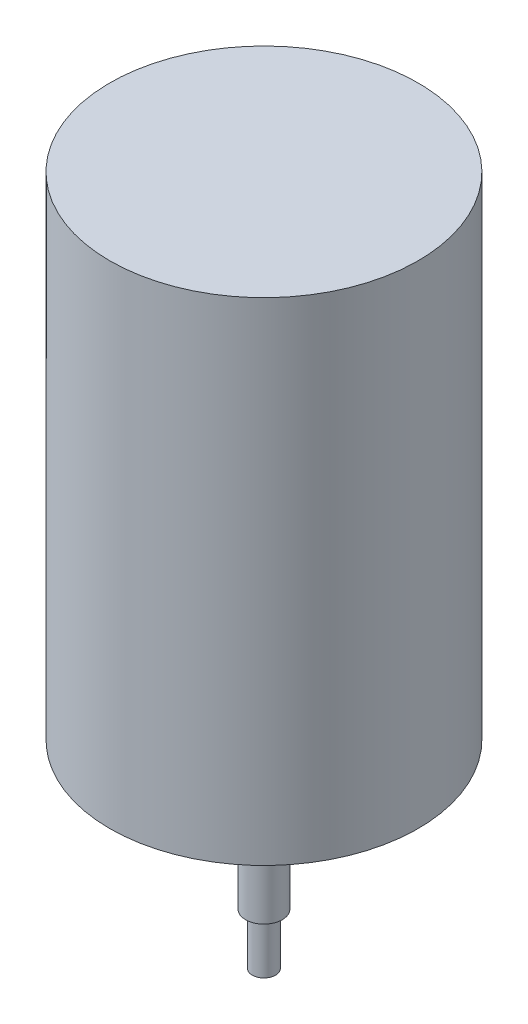
from build123d import *

# Parameters (mm, degrees)
SKETCH_1_R      = 21
EXTRUDE_1_DEPTH = 67
SKETCH_2_R      = 2.5
EXTRUDE_2_DEPTH = 20
SKETCH_3_R      = 1.5875
EXTRUDE_3_DEPTH = 7


with BuildPart() as part:
    # 草图1 → 凸台-拉伸1 (new body)
    with BuildSketch(Plane(origin=(0, 0, 0), x_dir=(1, 0, 0), z_dir=(0, 1, 0))):
        with Locations(Location((0, 0, 0), (0, 0, 270))):
            Circle(SKETCH_1_R)
    extrude(amount=EXTRUDE_1_DEPTH)

    # 草图2 → 凸台-拉伸2 (add)
    with BuildSketch(Plane.XZ):
        with Locations(Location((0, 0, 0), (0, 0, 90))):
            Circle(SKETCH_2_R)
    extrude(amount=EXTRUDE_2_DEPTH)

    # 草图3 → 凸台-拉伸3 (add)
    with BuildSketch(Plane.XZ.offset(20)):
        with Locations(Location((0, 0, 0), (0, 0, 270))):
            Circle(SKETCH_3_R)
    extrude(amount=EXTRUDE_3_DEPTH)


solid = part.part
